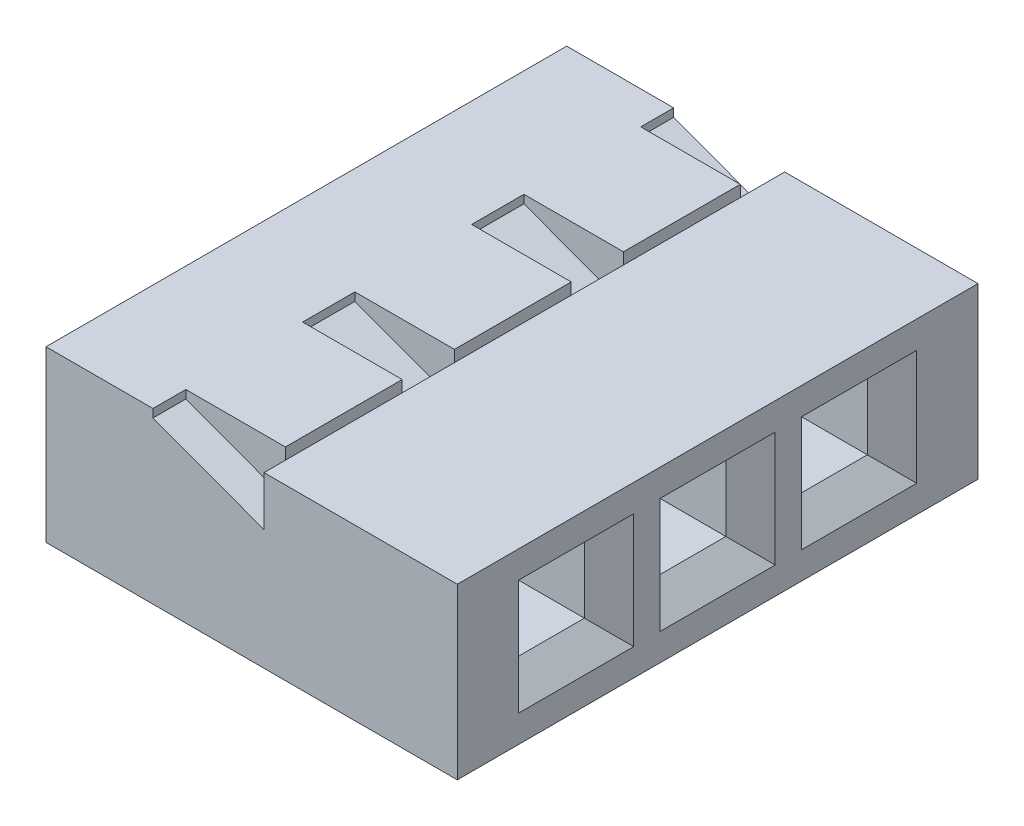
from build123d import *

# Parameters (mm, degrees)
SKETCH1_W           = 6.33
SKETCH1_H           = 2.06
SKETCH1_W_2         = 0.8
SKETCH1_H_2         = 0.8
BOSS_EXTRUDE1_DEPTH = 2.5
CUT_EXTRUDE1_DEPTH  = 7.25
SKETCH3_W           = 1.42
SKETCH3_H           = 0.63
BOSS_EXTRUDE2_DEPTH = 1.21
CHAMFER1_SIZE       = 0.3


with BuildPart() as part:
    # Sketch1 → Boss-Extrude1 (new, symmetric)
    with BuildSketch(Plane(origin=(0, 0, 0), x_dir=(0, 0, -1), z_dir=(1, 0, 0))):
        Rectangle(SKETCH1_W, SKETCH1_H)
        Rectangle(SKETCH1_W_2, SKETCH1_H_2, mode=Mode.SUBTRACT)
        with Locations((-1.72, 0)):
            Rectangle(SKETCH1_W_2, SKETCH1_H_2, mode=Mode.SUBTRACT)
        with Locations((1.72, 0)):
            Rectangle(SKETCH1_W_2, SKETCH1_H_2, mode=Mode.SUBTRACT)
    extrude(amount=BOSS_EXTRUDE1_DEPTH, both=True)

    # Sketch2 → Cut-Extrude1 (cut)
    with BuildSketch(Plane.XY.offset(3.165)):
        Polygon((-1.2, 2.722191774), (0.15, 2.722191774), (0.15, 0.43), (-1.2, 0.93), align=None)
    extrude(amount=-CUT_EXTRUDE1_DEPTH, mode=Mode.SUBTRACT)

    # Sketch3 → Boss-Extrude2 (add)
    with BuildSketch(Plane(origin=(-1.2, 0, 0), x_dir=(0, 0, -1), z_dir=(1, 0, 0))):
        with Locations((-2.055, 0.715)):
            Rectangle(SKETCH3_W, SKETCH3_H)
        with Locations((0, 0.715)):
            Rectangle(SKETCH3_W, SKETCH3_H)
        with Locations((2.055, 0.715)):
            Rectangle(SKETCH3_W, SKETCH3_H)
    extrude(amount=BOSS_EXTRUDE2_DEPTH)

    # Chamfer1
    chamfer1_edges = [part.edges().sort_by_distance(p)[0] for p in [
        (-2.5, 0, -0.4),
        (-2.5, 0.4, 0),
        (-2.5, 0, 0.4),
        (-2.5, -0.4, 0),
        (2.5, 0, -0.4),
        (2.5, 0.4, 0),
        (2.5, 0, 0.4),
        (2.5, -0.4, 0),
        (-2.5, 0, 1.32),
        (-2.5, 0.4, 1.72),
        (-2.5, 0, 2.12),
        (-2.5, -0.4, 1.72),
        (2.5, 0, 1.32),
        (2.5, 0.4, 1.72),
        (2.5, 0, 2.12),
        (2.5, -0.4, 1.72),
        (-2.5, 0, -2.12),
        (-2.5, 0.4, -1.72),
        (-2.5, 0, -1.32),
        (-2.5, -0.4, -1.72),
        (2.5, 0, -2.12),
        (2.5, 0.4, -1.72),
        (2.5, 0, -1.32),
        (2.5, -0.4, -1.72),
    ]]
    chamfer(chamfer1_edges, length=CHAMFER1_SIZE)


solid = part.part
